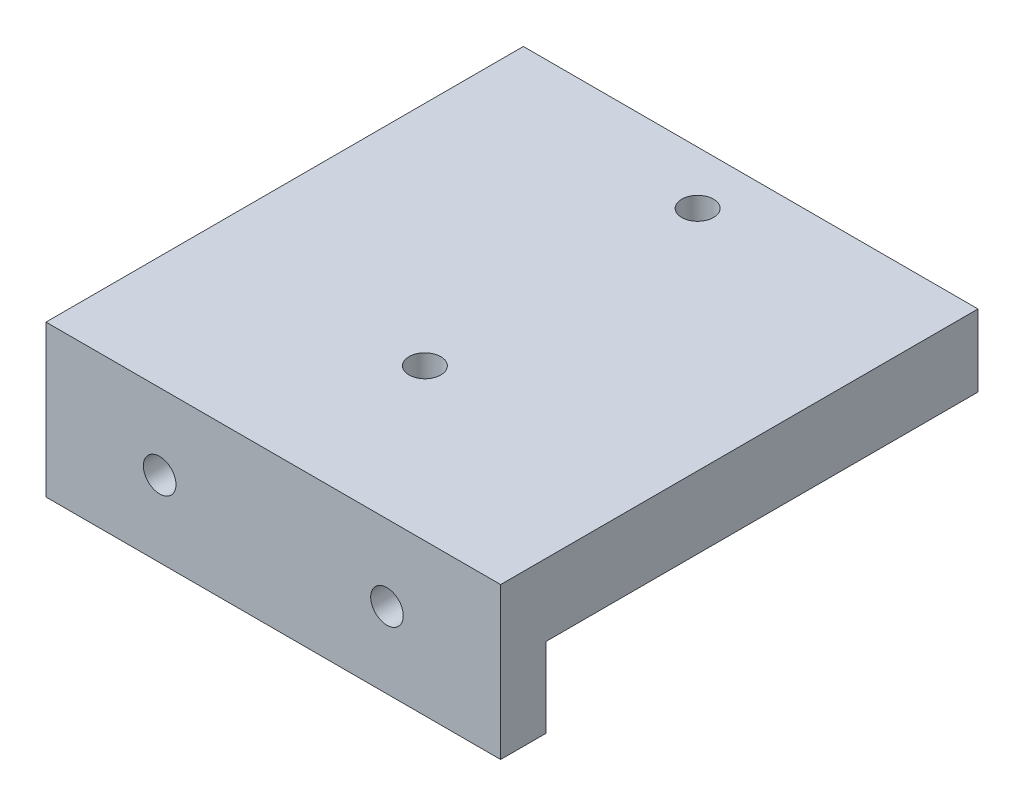
from build123d import *

# Parameters (mm, degrees)
SK_TOP_W              = 60
SK_TOP_H              = 63
EX_TOP_DEPTH          = 9.5
SK_BACKWALL_W         = 60
SK_BACKWALL_H         = 6
EX_BACKWALL_DEPTH     = 10.5
SK_RAILBOLTS_R        = 2.15
CUT_RAILBOLTS_DEPTH   = 8
SK_GUIDEPINS_R        = 2.1
CUT_GUIDEPINS_DEPTH   = 9.5
SK_SPRINGSEATS_R      = 5
CUT_SPRINGSEATS_DEPTH = 5


with BuildPart() as part:
    # SK_Top → EX_Top (new body)
    with BuildSketch(Plane(origin=(0, 14, 0), x_dir=(1, 0, 0), z_dir=(0, 1, 0))):
        with Locations((0, -6.5)):
            Rectangle(SK_TOP_W, SK_TOP_H)
    extrude(amount=EX_TOP_DEPTH)

    # SK_BackWall → EX_BackWall (add)
    with BuildSketch(Plane(origin=(0, 3.5, 0), x_dir=(1, 0, 0), z_dir=(0, 1, 0))):
        with Locations((0, -35)):
            Rectangle(SK_BACKWALL_W, SK_BACKWALL_H)
    extrude(amount=EX_BACKWALL_DEPTH)

    # SK_RailBolts → CUT_RailBolts (cut)
    with BuildSketch(Plane.XY.offset(38)):
        with Locations((15, 13.5)):
            Circle(SK_RAILBOLTS_R)
        with Locations((-15, 13.5)):
            Circle(SK_RAILBOLTS_R)
    extrude(amount=-CUT_RAILBOLTS_DEPTH, mode=Mode.SUBTRACT)

    # SK_GuidePins → CUT_GuidePins (cut)
    with BuildSketch(Plane(origin=(0, 14, 0), x_dir=(1, 0, 0), z_dir=(0, 1, 0))):
        with Locations((0, -18)):
            Circle(SK_GUIDEPINS_R)
        with Locations((0, 18)):
            Circle(SK_GUIDEPINS_R)
    extrude(amount=CUT_GUIDEPINS_DEPTH, mode=Mode.SUBTRACT)

    # SK_SpringSeats → CUT_SpringSeats (cut)
    with BuildSketch(Plane(origin=(0, 14, 0), x_dir=(1, 0, 0), z_dir=(0, 1, 0))):
        with Locations((18, 0)):
            Circle(SK_SPRINGSEATS_R)
        with Locations((-18, 0)):
            Circle(SK_SPRINGSEATS_R)
    extrude(amount=CUT_SPRINGSEATS_DEPTH, mode=Mode.SUBTRACT)


solid = part.part
